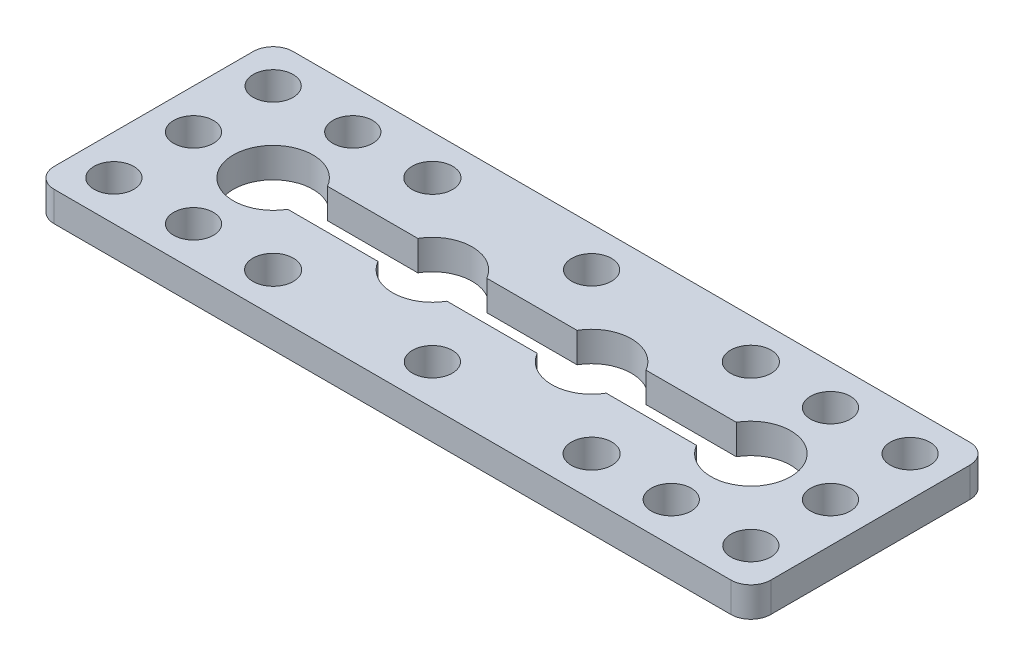
from build123d import *

# Parameters (mm, degrees)
SKETCH1_R           = 2
SKETCH1_R_2         = 2.032942559
BOSS_EXTRUDE2_DEPTH = 3


with BuildPart() as part:
    # Sketch1 → Boss-Extrude2 (new body)
    # profile 1 of 4: a face of its own
    with BuildSketch(Plane(origin=(0, 0, 0), x_dir=(1, 0, 0), z_dir=(0, 1, 0))):
        with BuildLine():
            Line((-33.892215569, -2.874251497), (0.107784431, -2.874251497))
            Line((0.107784431, -2.874251497), (0.107784431, -0.874251497))
            ThreePointArc((0.107784431, -0.874251497), (-1.892215569, 1.125748503), (0.107784431, 3.125748503))
            Line((0.107784431, 3.125748503), (0.107784431, 7.125748503))
            Line((0.107784431, 7.125748503), (-4.428113954, 7.125748503))
            ThreePointArc((-4.428113954, 7.125748503), (-7.892215569, 5.125748503), (-11.356317184, 7.125748503))
            Line((-11.356317184, 7.125748503), (-20.428113954, 7.125748503))
            ThreePointArc((-20.428113954, 7.125748503), (-24.927491749, 5.262045198), (-27.892215569, 9.125748503))
            Line((-27.892215569, 9.125748503), (-29.892215569, 9.125748503))
            ThreePointArc((-29.892215569, 9.125748503), (-31.892215569, 7.125748503), (-33.892215569, 9.125748503))
            Line((-33.892215569, 9.125748503), (-35.892215569, 9.125748503))
            Line((-35.892215569, 9.125748503), (-35.892215569, -0.874251497))
            ThreePointArc((-35.892215569, -0.874251497), (-35.306429131, -2.288465059), (-33.892215569, -2.874251497))
        make_face()
        with Locations(Location((-31.892215569, 1.125748503, 0), (0, 0, 270))):
            Circle(SKETCH1_R, mode=Mode.SUBTRACT)
        with Locations(Location((-23.892215569, 1.125748503, 0), (0, 0, 270))):
            Circle(SKETCH1_R, mode=Mode.SUBTRACT)
        with Locations(Location((-15.892215569, 1.125748503, 0), (0, 0, 270))):
            Circle(SKETCH1_R_2, mode=Mode.SUBTRACT)
    # profile 2 of 4: a face of its own
    with BuildSketch(Plane(origin=(0, 0, 0), x_dir=(1, 0, 0), z_dir=(0, 1, 0))):
        with BuildLine():
            Line((0.107784431, 19.125748503), (0.107784431, 21.125748503))
            Line((0.107784431, 21.125748503), (-33.892215569, 21.125748503))
            ThreePointArc((-33.892215569, 21.125748503), (-35.306429131, 20.539962065), (-35.892215569, 19.125748503))
            Line((-35.892215569, 19.125748503), (-35.892215569, 9.125748503))
            Line((-35.892215569, 9.125748503), (-33.892215569, 9.125748503))
            ThreePointArc((-33.892215569, 9.125748503), (-31.892215569, 11.125748503), (-29.892215569, 9.125748503))
            Line((-29.892215569, 9.125748503), (-27.892215569, 9.125748503))
            ThreePointArc((-27.892215569, 9.125748503), (-24.927491749, 12.989451808), (-20.428113954, 11.125748503))
            Line((-20.428113954, 11.125748503), (-11.356317184, 11.125748503))
            ThreePointArc((-11.356317184, 11.125748503), (-7.892215569, 13.125748503), (-4.428113954, 11.125748503))
            Line((-4.428113954, 11.125748503), (0.107784431, 11.125748503))
            Line((0.107784431, 11.125748503), (0.107784431, 15.125748503))
            ThreePointArc((0.107784431, 15.125748503), (-1.892215569, 17.125748503), (0.107784431, 19.125748503))
        make_face()
        with Locations(Location((-31.892215569, 17.125748503, 0), (0, 0, 270))):
            Circle(SKETCH1_R, mode=Mode.SUBTRACT)
        with Locations(Location((-23.892215569, 17.125748503, 0), (0, 0, 270))):
            Circle(SKETCH1_R, mode=Mode.SUBTRACT)
        with Locations(Location((-15.892215569, 17.125748503, 0), (0, 0, 270))):
            Circle(SKETCH1_R_2, mode=Mode.SUBTRACT)
    # profile 3 of 4: a face of its own
    with BuildSketch(Plane(origin=(0, 0, 0), x_dir=(1, 0, 0), z_dir=(0, 1, 0))):
        with BuildLine():
            Line((36.107784431, 9.125748503), (34.107784431, 9.125748503))
            ThreePointArc((34.107784431, 9.125748503), (32.107784431, 7.125748503), (30.107784431, 9.125748503))
            Line((30.107784431, 9.125748503), (28.107784431, 9.125748503))
            ThreePointArc((28.107784431, 9.125748503), (25.143060612, 5.262045198), (20.643682816, 7.125748503))
            Line((20.643682816, 7.125748503), (11.571886046, 7.125748503))
            ThreePointArc((11.571886046, 7.125748503), (8.107784431, 5.125748503), (4.643682816, 7.125748503))
            Line((4.643682816, 7.125748503), (0.107784431, 7.125748503))
            Line((0.107784431, 7.125748503), (0.107784431, 3.125748503))
            ThreePointArc((0.107784431, 3.125748503), (1.521997994, 2.539962065), (2.107784431, 1.125748503))
            ThreePointArc((2.107784431, 1.125748503), (1.521997994, -0.288465059), (0.107784431, -0.874251497))
            Line((0.107784431, -0.874251497), (0.107784431, -2.874251497))
            Line((0.107784431, -2.874251497), (34.107784431, -2.874251497))
            ThreePointArc((34.107784431, -2.874251497), (35.521997994, -2.288465059), (36.107784431, -0.874251497))
            Line((36.107784431, -0.874251497), (36.107784431, 9.125748503))
        make_face()
        with Locations(Location((16.107784431, 1.125748503, 0), (0, 0, 270))):
            Circle(SKETCH1_R_2, mode=Mode.SUBTRACT)
        with Locations(Location((24.107784431, 1.125748503, 0), (0, 0, 270))):
            Circle(SKETCH1_R, mode=Mode.SUBTRACT)
        with Locations(Location((32.107784431, 1.125748503, 0), (0, 0, 270))):
            Circle(SKETCH1_R, mode=Mode.SUBTRACT)
    # profile 4 of 4: a face of its own
    with BuildSketch(Plane(origin=(0, 0, 0), x_dir=(1, 0, 0), z_dir=(0, 1, 0))):
        with BuildLine():
            ThreePointArc((30.107784431, 9.125748503), (32.107784431, 11.125748503), (34.107784431, 9.125748503))
            Line((34.107784431, 9.125748503), (36.107784431, 9.125748503))
            Line((36.107784431, 9.125748503), (36.107784431, 19.125748503))
            ThreePointArc((36.107784431, 19.125748503), (35.521997994, 20.539962065), (34.107784431, 21.125748503))
            Line((34.107784431, 21.125748503), (0.107784431, 21.125748503))
            Line((0.107784431, 21.125748503), (0.107784431, 19.125748503))
            ThreePointArc((0.107784431, 19.125748503), (1.521997994, 18.539962065), (2.107784431, 17.125748503))
            ThreePointArc((2.107784431, 17.125748503), (1.521997994, 15.711534941), (0.107784431, 15.125748503))
            Line((0.107784431, 15.125748503), (0.107784431, 11.125748503))
            Line((0.107784431, 11.125748503), (4.643682816, 11.125748503))
            ThreePointArc((4.643682816, 11.125748503), (8.107784431, 13.125748503), (11.571886046, 11.125748503))
            Line((11.571886046, 11.125748503), (20.643682816, 11.125748503))
            ThreePointArc((20.643682816, 11.125748503), (25.143060612, 12.989451808), (28.107784431, 9.125748503))
            Line((28.107784431, 9.125748503), (30.107784431, 9.125748503))
        make_face()
        with Locations(Location((16.107784431, 17.125748503, 0), (0, 0, 270))):
            Circle(SKETCH1_R_2, mode=Mode.SUBTRACT)
        with Locations(Location((24.107784431, 17.125748503, 0), (0, 0, 270))):
            Circle(SKETCH1_R, mode=Mode.SUBTRACT)
        with Locations(Location((32.107784431, 17.125748503, 0), (0, 0, 270))):
            Circle(SKETCH1_R, mode=Mode.SUBTRACT)
    extrude(amount=BOSS_EXTRUDE2_DEPTH)


solid = part.part
